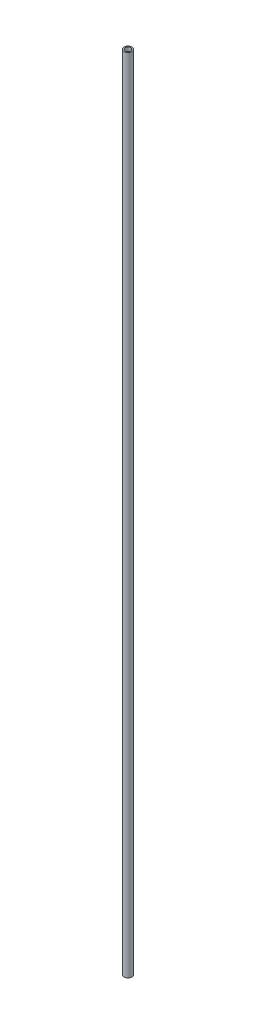
from build123d import *

# Parameters (mm, degrees)
SKETCH1_R           = 3.5
SKETCH1_R_2         = 2.5
BOSS_EXTRUDE1_DEPTH = 700


with BuildPart() as part:
    # Sketch1 → Boss-Extrude1 (new body)
    with BuildSketch(Plane(origin=(0, 0, 0), x_dir=(1, 0, 0), z_dir=(0, 1, 0))):
        with Locations(Location((0, 0, 0), (0, 0, 270))):
            Circle(SKETCH1_R)
        with Locations(Location((0, 0, 0), (0, 0, 270))):
            Circle(SKETCH1_R_2, mode=Mode.SUBTRACT)
    extrude(amount=BOSS_EXTRUDE1_DEPTH)


solid = part.part
